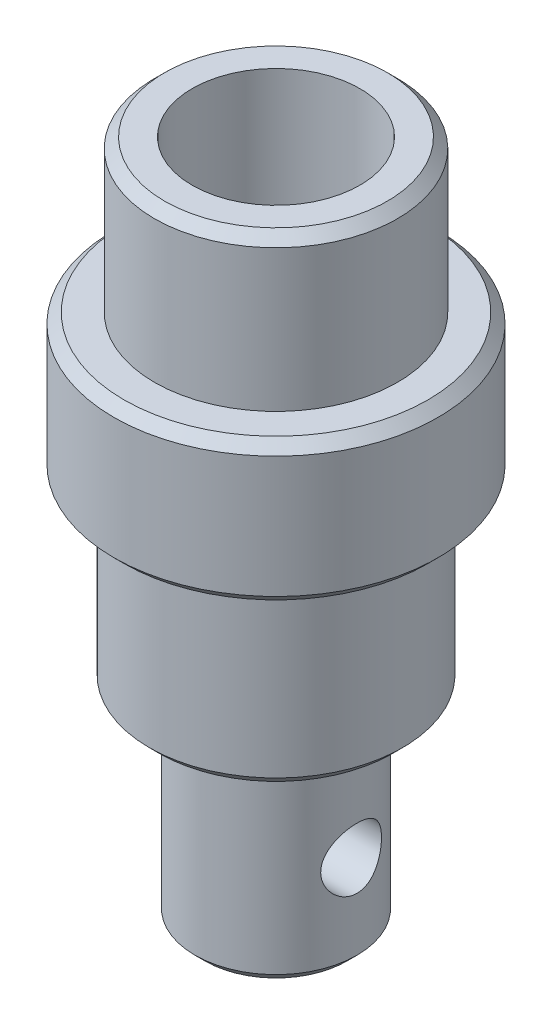
from build123d import *

# Parameters (mm, degrees)
SKETCH1_R               = 12.5
BOSS_EXTRUDE1_DEPTH     = 67
SKETCH14_R              = 16
BOSS_EXTRUDE2_DEPTH     = 29
SKETCH4_R               = 8.2804
CUT_EXTRUDE2_DEPTH      = 18
SKETCH8_OUTSIDE_W       = 50.17
SKETCH8_OUTSIDE_H       = 50.17
SKETCH8_OUTSIDE_R       = 12
CUT_EXTRUDE4_DEPTH      = 15
CHAMFER1_SIZE           = 1
SKETCH25_OUTSIDE_W      = 50.17
SKETCH25_OUTSIDE_H      = 50.17
SKETCH25_OUTSIDE_R      = 8
CUT_EXTRUDE7_DEPTH      = 20
CHAMFER2_SIZE           = 1
CUT_EXTRUDE8_DEPTH      = 71.717748833
CUT_EXTRUDE8_DEPTH_BACK = 71.717748833
SKETCH26_R              = 3


with BuildPart() as part:
    # Sketch1 → Boss-Extrude1 (new body)
    with BuildSketch(Plane(origin=(0, 0, 0), x_dir=(1, 0, 0), z_dir=(0, 1, 0))):
        with Locations(Location((0, 0, 0), (0, 0, 270))):
            Circle(SKETCH1_R)
    extrude(amount=BOSS_EXTRUDE1_DEPTH)

    # Sketch14 → Boss-Extrude2 (add)
    with BuildSketch(Plane(origin=(0, 67, 0), x_dir=(1, 0, 0), z_dir=(0, 1, 0))):
        with Locations(Location((0, 0, 0), (0, 0, 270))):
            Circle(SKETCH14_R)
    extrude(amount=-BOSS_EXTRUDE2_DEPTH)

    # Sketch4 → Cut-Extrude2 (cut)
    with BuildSketch(Plane(origin=(0, 67, 0), x_dir=(1, 0, 0), z_dir=(0, 1, 0))):
        with Locations(Location((0, 0, 0), (0, 0, 270))):
            Circle(SKETCH4_R)
    extrude(amount=-CUT_EXTRUDE2_DEPTH, mode=Mode.SUBTRACT)

    # Sketch8 outside → Cut-Extrude4 (cut)
    with BuildSketch(Plane(origin=(0, 67, 0), x_dir=(1, 0, 0), z_dir=(0, 1, 0))):
        Rectangle(SKETCH8_OUTSIDE_W, SKETCH8_OUTSIDE_H)
        with Locations(Location((0, 0, 0), (0, 0, 270))):
            Circle(SKETCH8_OUTSIDE_R, mode=Mode.SUBTRACT)
    extrude(amount=-CUT_EXTRUDE4_DEPTH, mode=Mode.SUBTRACT)

    # Chamfer1
    chamfer1_edges = [part.edges().sort_by_distance(p)[0] for p in [
        (0, 52, -16),
        (0, 38, -16),
    ]]
    chamfer(chamfer1_edges, length=CHAMFER1_SIZE)

    # Sketch25 outside → Cut-Extrude7 (cut)
    with BuildSketch(Plane.XZ):
        Rectangle(SKETCH25_OUTSIDE_W, SKETCH25_OUTSIDE_H)
        with Locations(Location((0, 0, 0), (0, 0, 270))):
            Circle(SKETCH25_OUTSIDE_R, mode=Mode.SUBTRACT)
    extrude(amount=-CUT_EXTRUDE7_DEPTH, mode=Mode.SUBTRACT)

    # Chamfer2
    chamfer2_edges = [part.edges().sort_by_distance(p)[0] for p in [
        (0, 67, -12),
        (0, 20, -12.5),
        (0, 0, 8),
    ]]
    chamfer(chamfer2_edges, length=CHAMFER2_SIZE)

    # Sketch26 → Cut-Extrude8 (cut, two sides: drawn at the far end of the back side and taken through both)
    with BuildSketch(Plane(origin=(0, 0, 0), x_dir=(0, 0, -1), z_dir=(1, 0, 0)).offset(-CUT_EXTRUDE8_DEPTH_BACK)):
        with Locations((0, 9.3)):
            Circle(SKETCH26_R)
    extrude(amount=CUT_EXTRUDE8_DEPTH + CUT_EXTRUDE8_DEPTH_BACK, mode=Mode.SUBTRACT)


solid = part.part
